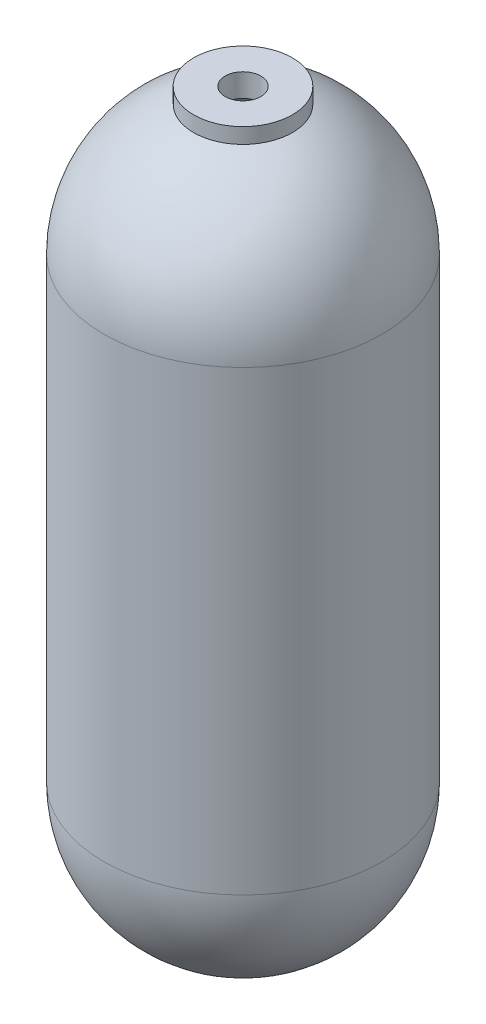
from build123d import *

# Parameters (mm, degrees)
F_5_8_18_TAPPED_HOLE2_D     = 14.68374
F_5_8_18_TAPPED_HOLE2_DEPTH = 38.862
F_5_8_18_TAPPED_HOLE2_TIP   = 4.411440553


with BuildPart() as part:
    # Sketch4 → Revolve1 (revolve)
    with BuildSketch(Plane.XY):
        with BuildLine():
            Line((20.32, 59.765541746), (20.32, 53.415541746))
            ThreePointArc((20.32, 53.415541746), (47.050029224, 32.440981027), (57.15, 0))
            Line((57.15, 0), (57.15, -187.884458254))
            ThreePointArc((57.15, -187.884458254), (40.411152545, -228.295610799), (0, -245.034458254))
            Line((0, -245.034458254), (0, -238.684458254))
            ThreePointArc((0, -238.684458254), (35.921024484, -223.805482738), (50.8, -187.884458254))
            Line((50.8, -187.884458254), (50.8, 0))
            ThreePointArc((50.8, 0), (40.560547334, 30.58565023), (13.97, 48.841366688))
            ThreePointArc((13.97, 48.841366688), (8.309203928, 50.115837118), (2.54, 50.736460263))
            Line((2.54, 50.736460263), (2.54, 59.765541746))
            Line((2.54, 59.765541746), (13.97, 59.765541746))
            Line((13.97, 59.765541746), (20.32, 59.765541746))
        make_face()
    revolve(axis=Axis((0, 80.447885323, 0), (0, -1, 0)))

    # 5/8-18 Tapped Hole2
    with Locations(Plane(origin=(0, 59.765541746, 0), x_dir=(1, 0, 0), z_dir=(0, 1, 0))):
        with Locations((0, 0)):
            Hole(F_5_8_18_TAPPED_HOLE2_D / 2, depth=F_5_8_18_TAPPED_HOLE2_DEPTH)
            with Locations((0, 0, -(F_5_8_18_TAPPED_HOLE2_DEPTH + F_5_8_18_TAPPED_HOLE2_TIP / 2))):  # 118° drill point
                Cone(0, F_5_8_18_TAPPED_HOLE2_D / 2, F_5_8_18_TAPPED_HOLE2_TIP, mode=Mode.SUBTRACT)


solid = part.part
